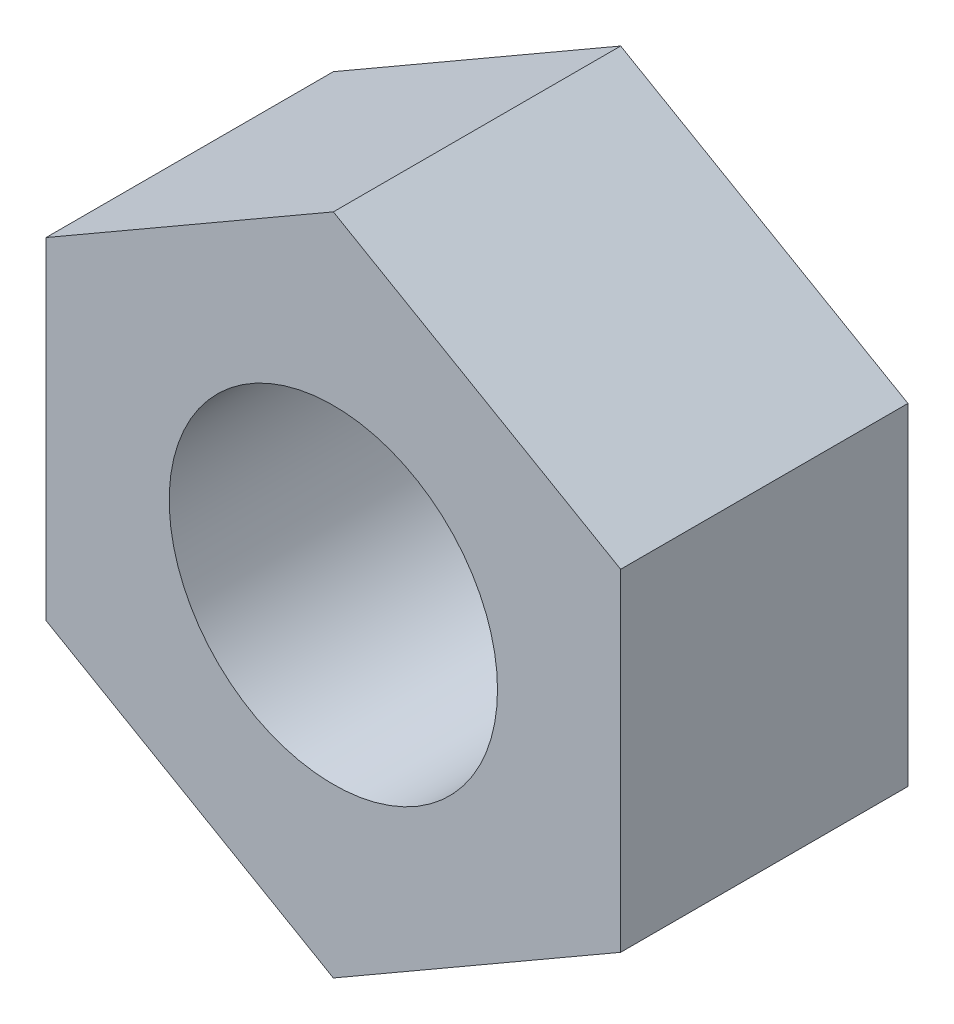
from build123d import *

# Parameters (mm, degrees)
SKETCH1_R      = 3.175
EXTRUDE1_DEPTH = 2.778125


with BuildPart() as part:
    # Sketch1 → Extrude1 (new, symmetric)
    with BuildSketch(Plane.XY):
        Polygon((-5.55625, 3.207902433), (-5.55625, -3.207902433), (0, -6.415804866), (5.55625, -3.207902433), (5.55625, 3.207902433), (0, 6.415804866), align=None)
        Circle(SKETCH1_R, mode=Mode.SUBTRACT)
    extrude(amount=EXTRUDE1_DEPTH, both=True)


solid = part.part
